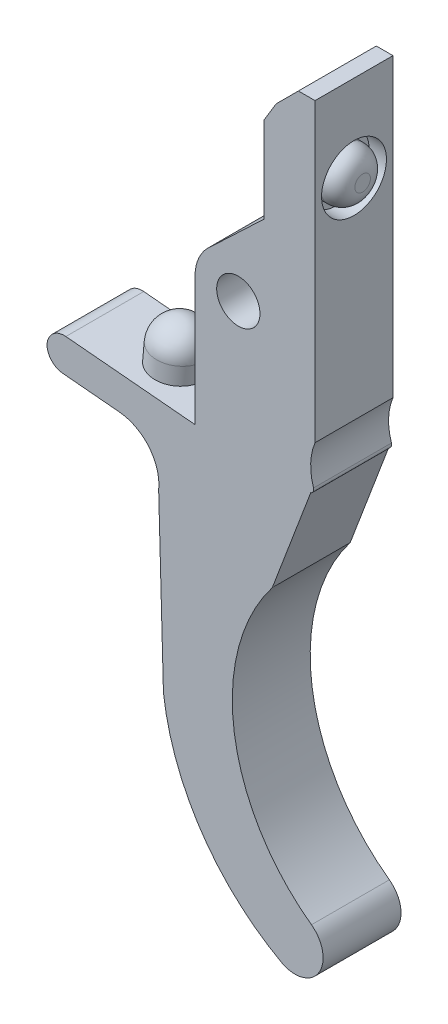
from build123d import *

# Parameters (mm, degrees)
SKETCH_1_R          = 5
SKETCH_1_R_2        = 2.5
EXTRUDE_1_DEPTH     = 9
SKETCH_2_R          = 3.75
CUT_EXTRUDE_1_DEPTH = 2
SKETCH_3_R          = 2.9
EXTRUDE_2_DEPTH     = 3
FILLET_1_R          = 2
SKETCH_4_R          = 2.9
EXTRUDE_3_DEPTH     = 5
FILLET_2_R          = 2.9


with BuildPart() as part:
    # 스케치1 → 보스-돌출1 (new body)
    # profile 1 of 5: a face of its own
    with BuildSketch(Plane.XY):
        with BuildLine():
            Line((8.866410343, 21.94338903), (4.384187039, 21.94338903))
            Line((4.384187039, 21.94338903), (2.987768149, 19.65002342))
            Line((2.987768149, 19.65002342), (2.987768149, 17.661246793))
            Line((2.987768149, 17.661246793), (2.987768149, 9.70876495))
            Line((2.987768149, 9.70876495), (-3.184671245, 3.854590647))
            ThreePointArc((-3.184671245, 3.854590647), (2.13033375, 4.523458645), (5, 0))
            ThreePointArc((5, 0), (0, -5), (-5, 0))
            Line((-5, 0), (-5, -14.85442617))
            Line((-5, -14.85442617), (-19.921487255, -13.496967469))
            ThreePointArc((-19.921487255, -13.496967469), (-21.453925628, -14.014242075), (-22.102673306, -15.49581787))
            ThreePointArc((-22.102673306, -15.49581787), (-21.54079944, -16.765444299), (-20.287735083, -17.363343312))
            Line((-20.287735083, -17.363343312), (-13.716958703, -17.9611093))
            ThreePointArc((-13.716958703, -17.9611093), (-10.295562947, -19.77999502), (-9.201017746, -23.497018692))
            Line((-9.201017746, -23.497018692), (-8.648726299, -43.504972105))
            ThreePointArc((-8.648726299, -43.504972105), (-4.194233385, -55.315987694), (5.178631732, -63.771281648))
            ThreePointArc((5.178631732, -63.771281648), (9.354068035, -62.453221011), (8.453005262, -58.168406191))
            ThreePointArc((8.453005262, -58.168406191), (-0.467627925, -43.39335713), (3.924251711, -26.702306699))
            Line((3.924251711, -26.702306699), (8.3701186, -14.978169718))
            ThreePointArc((8.3701186, -14.978169718), (8.662275884, -14.729272874), (8.69193724, -14.346616734))
            ThreePointArc((8.69193724, -14.346616734), (8.365752146, -12.021808556), (8.866410343, -9.728236855))
            Line((8.866410343, -9.728236855), (8.866410343, 21.94338903))
        make_face()
    # profile 2 of 5: a face of its own
    with BuildSketch(Plane.XY):
        Circle(SKETCH_1_R)
        Circle(SKETCH_1_R_2, mode=Mode.SUBTRACT)
    # profile 3 of 5: a face of its own
    with BuildSketch(Plane.XY):
        with BuildLine():
            ThreePointArc((5, 0), (2.13033375, 4.523458645), (-3.184671245, 3.854590647))
            ThreePointArc((-3.184671245, 3.854590647), (-4.523458645, 2.13033375), (-5, 0))
            ThreePointArc((-5, 0), (0, -5), (5, 0))
        make_face()
        Circle(SKETCH_1_R_2, mode=Mode.SUBTRACT)
    # profile 4 of 5: a face of its own
    with BuildSketch(Plane.XY):
        Polygon((8.866410343, 24.501339074), (6.942137083, 24.501339074), (4.384187039, 21.94338903), (8.866410343, 21.94338903), align=None)
    # profile 5 of 5: a face of its own
    with BuildSketch(Plane.XY):
        with BuildLine():
            Line((8.866410343, 21.94338903), (4.384187039, 21.94338903))
            Line((4.384187039, 21.94338903), (2.987768149, 19.65002342))
            Line((2.987768149, 19.65002342), (2.987768149, 17.661246793))
            Line((2.987768149, 17.661246793), (2.987768149, 9.70876495))
            Line((2.987768149, 9.70876495), (-3.184671245, 3.854590647))
            ThreePointArc((-3.184671245, 3.854590647), (2.13033375, 4.523458645), (5, 0))
            ThreePointArc((5, 0), (0, -5), (-5, 0))
            Line((-5, 0), (-5, -14.85442617))
            Line((-5, -14.85442617), (-19.921487255, -13.496967469))
            ThreePointArc((-19.921487255, -13.496967469), (-21.453925628, -14.014242075), (-22.102673306, -15.49581787))
            ThreePointArc((-22.102673306, -15.49581787), (-21.54079944, -16.765444299), (-20.287735083, -17.363343312))
            Line((-20.287735083, -17.363343312), (-13.716958703, -17.9611093))
            ThreePointArc((-13.716958703, -17.9611093), (-10.295562947, -19.77999502), (-9.201017746, -23.497018692))
            Line((-9.201017746, -23.497018692), (-8.648726299, -43.504972105))
            ThreePointArc((-8.648726299, -43.504972105), (-4.194233385, -55.315987694), (5.178631732, -63.771281648))
            ThreePointArc((5.178631732, -63.771281648), (9.354068035, -62.453221011), (8.453005262, -58.168406191))
            ThreePointArc((8.453005262, -58.168406191), (-0.467627925, -43.39335713), (3.924251711, -26.702306699))
            Line((3.924251711, -26.702306699), (8.3701186, -14.978169718))
            ThreePointArc((8.3701186, -14.978169718), (8.662275884, -14.729272874), (8.69193724, -14.346616734))
            ThreePointArc((8.69193724, -14.346616734), (8.365752146, -12.021808556), (8.866410343, -9.728236855))
            Line((8.866410343, -9.728236855), (8.866410343, 21.94338903))
        make_face()
    extrude(amount=EXTRUDE_1_DEPTH)

    # 스케치2 → 컷-돌출1 (cut)
    with BuildSketch(Plane(origin=(8.866410343, 0, 0), x_dir=(0, 0, -1), z_dir=(1, 0, 0))):
        with Locations(Location((-4.5, 14.501339074, 0), (0, 0, 90))):
            Circle(SKETCH_2_R)
    extrude(amount=-CUT_EXTRUDE_1_DEPTH, mode=Mode.SUBTRACT)

    # 스케치3 → 보스-돌출2 (add)
    with BuildSketch(Plane(origin=(6.866410343, 0, 0), x_dir=(0, 0, -1), z_dir=(1, 0, 0))):
        with Locations(Location((-4.5, 14.501339074, 0), (0, 0, 90))):
            Circle(SKETCH_3_R)
    extrude(amount=EXTRUDE_2_DEPTH)

    # 필렛1
    fillet_1_edges = [part.edges().sort_by_distance(p)[0] for p in [
        (9.866410343, 11.601339074, 4.5),
    ]]
    fillet(fillet_1_edges, radius=FILLET_1_R)

    # 스케치4 → 보스-돌출3 (add)
    with BuildSketch(Plane(origin=(-1.381306819, -15.183631058, 0), x_dir=(0.995887428286197, -0.09059928355955607, 0), z_dir=(0.09059928355955607, 0.995887428286197, 0))):
        with Locations((-10.133636773, -4.5)):
            Circle(SKETCH_4_R)
    extrude(amount=EXTRUDE_3_DEPTH)

    # 필렛2
    fillet_2_edges = [part.edges().sort_by_distance(p)[0] for p in [
        (-13.908345408, -9.023355763, 4.5),
    ]]
    fillet(fillet_2_edges, radius=FILLET_2_R)


solid = part.part
